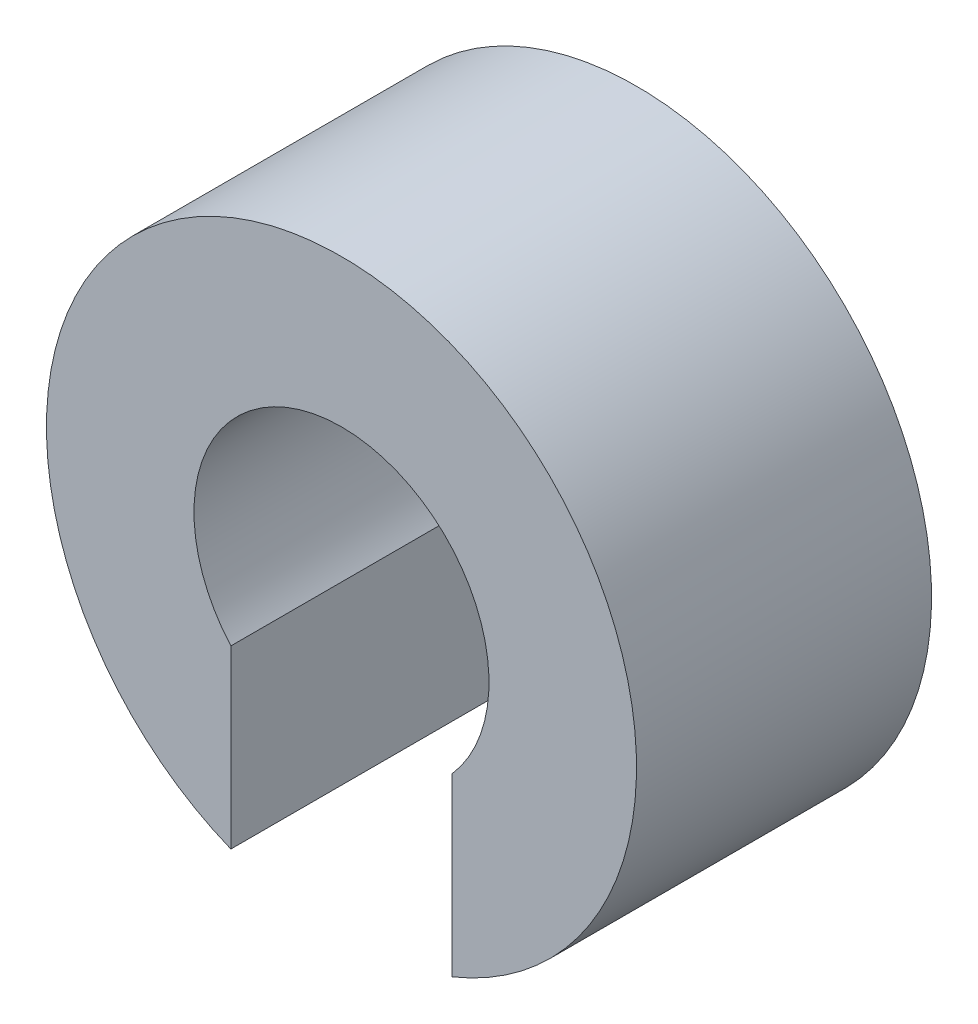
from build123d import *

# Parameters (mm, degrees)
SKETCH1_R          = 4
SKETCH1_R_2        = 2
EXTRUDE1_DEPTH     = 4
SKETCH2_W          = 3
SKETCH2_H          = 2.677124344
CUT_EXTRUDE1_DEPTH = 4


with BuildPart() as part:
    # Sketch1 → Extrude1 (new body)
    with BuildSketch(Plane.XY):
        Circle(SKETCH1_R)
        Circle(SKETCH1_R_2, mode=Mode.SUBTRACT)
    extrude(amount=EXTRUDE1_DEPTH)

    # Sketch2 → Cut-Extrude1 (cut)
    with BuildSketch(Plane.XY.offset(4)):
        with Locations((0, -2.661437828)):
            Rectangle(SKETCH2_W, SKETCH2_H)
    extrude(amount=-CUT_EXTRUDE1_DEPTH, mode=Mode.SUBTRACT)


solid = part.part
